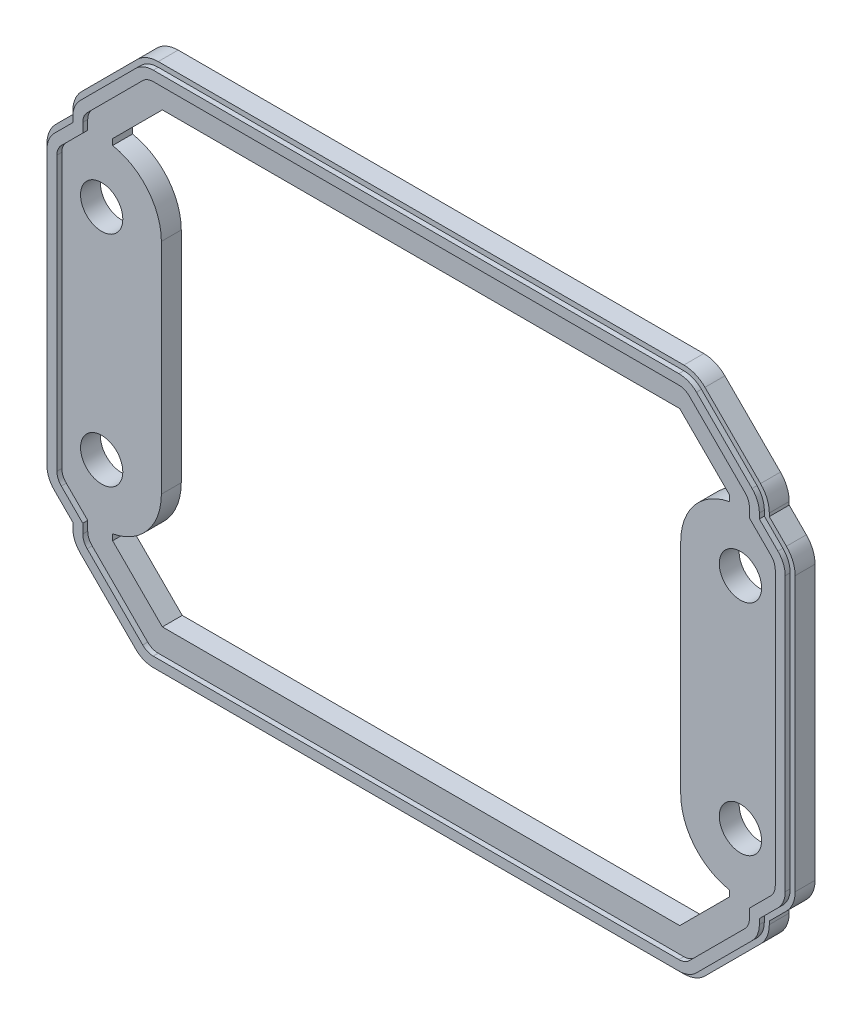
from build123d import *

# Parameters (mm, degrees)
SKETCH1_R           = 2.125
BOSS_EXTRUDE1_DEPTH = 2
BOSS_EXTRUDE2_DEPTH = 0.5


with BuildPart() as part:
    # Sketch1 → Boss-Extrude1 (new body)
    with BuildSketch(Plane.XY):
        with BuildLine():
            Line((-64.378174593, 10.621320344), (-62.656854249, 8.9))
            Line((-62.656854249, 8.9), (-62.656854249, 8.585786438))
            ThreePointArc((-62.656854249, 8.585786438), (-62.428492847, 7.437736141), (-61.778174593, 6.464466094))
            Line((-61.778174593, 6.464466094), (-56.192388155, 0.878679656))
            ThreePointArc((-56.192388155, 0.878679656), (-55.219118109, 0.228361402), (-54.071067812, 0))
            Line((-54.071067812, 0), (-1.242640687, 0))
            ThreePointArc((-1.242640687, 0), (-0.09459039, 0.228361402), (0.878679656, 0.878679656))
            Line((0.878679656, 0.878679656), (6.464466094, 6.464466094))
            ThreePointArc((6.464466094, 6.464466094), (7.114784348, 7.437736141), (7.343145751, 8.585786438))
            Line((7.343145751, 8.585786438), (7.343145751, 8.9))
            Line((7.343145751, 8.9), (9.064466094, 10.621320344))
            ThreePointArc((9.064466094, 10.621320344), (9.714784348, 11.59459039), (9.943145751, 12.742640687))
            Line((9.943145751, 12.742640687), (9.943145751, 40.257359313))
            ThreePointArc((9.943145751, 40.257359313), (9.714784348, 41.40540961), (9.064466094, 42.378679656))
            Line((9.064466094, 42.378679656), (7.343145751, 44.1))
            Line((7.343145751, 44.1), (7.343145751, 44.414213562))
            ThreePointArc((7.343145751, 44.414213562), (7.114784348, 45.562263859), (6.464466094, 46.535533906))
            Line((6.464466094, 46.535533906), (0.878679656, 52.121320344))
            ThreePointArc((0.878679656, 52.121320344), (-0.09459039, 52.771638598), (-1.242640687, 53))
            Line((-1.242640687, 53), (-54.071067812, 53))
            ThreePointArc((-54.071067812, 53), (-55.219118109, 52.771638598), (-56.192388155, 52.121320344))
            Line((-56.192388155, 52.121320344), (-61.778174593, 46.535533906))
            ThreePointArc((-61.778174593, 46.535533906), (-62.428492847, 45.562263859), (-62.656854249, 44.414213562))
            Line((-62.656854249, 44.414213562), (-62.656854249, 44.1))
            Line((-62.656854249, 44.1), (-64.378174593, 42.378679656))
            ThreePointArc((-64.378174593, 42.378679656), (-65.028492847, 41.40540961), (-65.256854249, 40.257359313))
            Line((-65.256854249, 40.257359313), (-65.256854249, 12.742640687))
            ThreePointArc((-65.256854249, 12.742640687), (-65.028492847, 11.59459039), (-64.378174593, 10.621320344))
        make_face()
        with Locations((4.443145751, 37.5)):
            Circle(SKETCH1_R, mode=Mode.SUBTRACT)
        with Locations((-59.756854249, 37.5)):
            Circle(SKETCH1_R, mode=Mode.SUBTRACT)
        with Locations((-59.756854249, 15.5)):
            Circle(SKETCH1_R, mode=Mode.SUBTRACT)
        with Locations((4.443145751, 15.5)):
            Circle(SKETCH1_R, mode=Mode.SUBTRACT)
        with BuildLine():
            Line((-1.656854249, 49), (-53.656854249, 49))
            Line((-53.656854249, 49), (-58.656854249, 44))
            Line((-58.656854249, 44), (-58.656854249, 43.398304841))
            ThreePointArc((-58.656854249, 43.398304841), (-55.141661946, 41.334057903), (-53.756854249, 37.5))
            Line((-53.756854249, 37.5), (-53.756854249, 15.5))
            ThreePointArc((-53.756854249, 15.5), (-55.141661946, 11.665942097), (-58.656854249, 9.601695159))
            Line((-58.656854249, 9.601695159), (-58.656854249, 9))
            Line((-58.656854249, 9), (-53.656854249, 4))
            Line((-53.656854249, 4), (-1.656854249, 4))
            Line((-1.656854249, 4), (3.343145751, 9))
            Line((3.343145751, 9), (3.343145751, 9.601695159))
            ThreePointArc((3.343145751, 9.601695159), (-0.172046553, 11.665942097), (-1.556854249, 15.5))
            Line((-1.556854249, 15.5), (-1.556854249, 37.5))
            ThreePointArc((-1.556854249, 37.5), (-0.172046553, 41.334057903), (3.343145751, 43.398304841))
            Line((3.343145751, 43.398304841), (3.343145751, 44))
            Line((3.343145751, 44), (-1.656854249, 49))
        make_face(mode=Mode.SUBTRACT)
    extrude(amount=BOSS_EXTRUDE1_DEPTH)

    # Sketch2 → Boss-Extrude2 (add)
    with BuildSketch(Plane.XY.offset(2)):
        with BuildLine():
            Line((-62.156854249, 9.107106781), (-62.156854249, 8.585786438))
            ThreePointArc((-62.156854249, 8.585786438), (-61.966553081, 7.629077857), (-61.424621202, 6.818019485))
            Line((-61.424621202, 6.818019485), (-55.838834765, 1.232233047))
            ThreePointArc((-55.838834765, 1.232233047), (-55.027776393, 0.690301169), (-54.071067812, 0.5))
            Line((-54.071067812, 0.5), (-1.242640687, 0.5))
            ThreePointArc((-1.242640687, 0.5), (-0.285932106, 0.690301169), (0.525126266, 1.232233047))
            Line((0.525126266, 1.232233047), (6.110912703, 6.818019485))
            ThreePointArc((6.110912703, 6.818019485), (6.652844582, 7.629077857), (6.843145751, 8.585786438))
            Line((6.843145751, 8.585786438), (6.843145751, 9.107106781))
            Line((6.843145751, 9.107106781), (8.710912703, 10.974873734))
            ThreePointArc((8.710912703, 10.974873734), (9.252844582, 11.785932106), (9.443145751, 12.742640687))
            Line((9.443145751, 12.742640687), (9.443145751, 40.257359313))
            ThreePointArc((9.443145751, 40.257359313), (9.252844582, 41.214067894), (8.710912703, 42.025126266))
            Line((8.710912703, 42.025126266), (6.843145751, 43.892893219))
            Line((6.843145751, 43.892893219), (6.843145751, 44.414213562))
            ThreePointArc((6.843145751, 44.414213562), (6.652844582, 45.370922143), (6.110912703, 46.181980515))
            Line((6.110912703, 46.181980515), (0.525126266, 51.767766953))
            ThreePointArc((0.525126266, 51.767766953), (-0.285932106, 52.309698831), (-1.242640687, 52.5))
            Line((-1.242640687, 52.5), (-54.071067812, 52.5))
            ThreePointArc((-54.071067812, 52.5), (-55.027776393, 52.309698831), (-55.838834765, 51.767766953))
            Line((-55.838834765, 51.767766953), (-61.424621202, 46.181980515))
            ThreePointArc((-61.424621202, 46.181980515), (-61.966553081, 45.370922143), (-62.156854249, 44.414213562))
            Line((-62.156854249, 44.414213562), (-62.156854249, 43.892893219))
            Line((-62.156854249, 43.892893219), (-64.024621202, 42.025126266))
            ThreePointArc((-64.024621202, 42.025126266), (-64.566553081, 41.214067894), (-64.756854249, 40.257359313))
            Line((-64.756854249, 40.257359313), (-64.756854249, 12.742640687))
            ThreePointArc((-64.756854249, 12.742640687), (-64.566553081, 11.785932106), (-64.024621202, 10.974873734))
            Line((-64.024621202, 10.974873734), (-62.156854249, 9.107106781))
        make_face()
        with BuildLine():
            Line((-61.156854249, 9.521320344), (-61.156854249, 8.585786438))
            ThreePointArc((-61.156854249, 8.585786438), (-61.042673548, 8.011761289), (-60.717514421, 7.525126266))
            Line((-60.717514421, 7.525126266), (-55.131727984, 1.939339828))
            ThreePointArc((-55.131727984, 1.939339828), (-54.64509296, 1.614180701), (-54.071067812, 1.5))
            Line((-54.071067812, 1.5), (-1.242640687, 1.5))
            ThreePointArc((-1.242640687, 1.5), (-0.668615539, 1.614180701), (-0.181980515, 1.939339828))
            Line((-0.181980515, 1.939339828), (5.403805922, 7.525126266))
            ThreePointArc((5.403805922, 7.525126266), (5.728965049, 8.011761289), (5.843145751, 8.585786438))
            Line((5.843145751, 8.585786438), (5.843145751, 9.521320344))
            Line((5.843145751, 9.521320344), (8.003805922, 11.681980515))
            ThreePointArc((8.003805922, 11.681980515), (8.328965049, 12.168615539), (8.443145751, 12.742640687))
            Line((8.443145751, 12.742640687), (8.443145751, 40.257359313))
            ThreePointArc((8.443145751, 40.257359313), (8.328965049, 40.831384461), (8.003805922, 41.318019485))
            Line((8.003805922, 41.318019485), (5.843145751, 43.478679656))
            Line((5.843145751, 43.478679656), (5.843145751, 44.414213562))
            ThreePointArc((5.843145751, 44.414213562), (5.728965049, 44.988238711), (5.403805922, 45.474873734))
            Line((5.403805922, 45.474873734), (-0.181980515, 51.060660172))
            ThreePointArc((-0.181980515, 51.060660172), (-0.668615539, 51.385819299), (-1.242640687, 51.5))
            Line((-1.242640687, 51.5), (-54.071067812, 51.5))
            ThreePointArc((-54.071067812, 51.5), (-54.64509296, 51.385819299), (-55.131727984, 51.060660172))
            Line((-55.131727984, 51.060660172), (-60.717514421, 45.474873734))
            ThreePointArc((-60.717514421, 45.474873734), (-61.042673548, 44.988238711), (-61.156854249, 44.414213562))
            Line((-61.156854249, 44.414213562), (-61.156854249, 43.478679656))
            Line((-61.156854249, 43.478679656), (-63.317514421, 41.318019485))
            ThreePointArc((-63.317514421, 41.318019485), (-63.642673548, 40.831384461), (-63.756854249, 40.257359313))
            Line((-63.756854249, 40.257359313), (-63.756854249, 12.742640687))
            ThreePointArc((-63.756854249, 12.742640687), (-63.642673548, 12.168615539), (-63.317514421, 11.681980515))
            Line((-63.317514421, 11.681980515), (-61.156854249, 9.521320344))
        make_face(mode=Mode.SUBTRACT)
    extrude(amount=BOSS_EXTRUDE2_DEPTH)


solid = part.part
